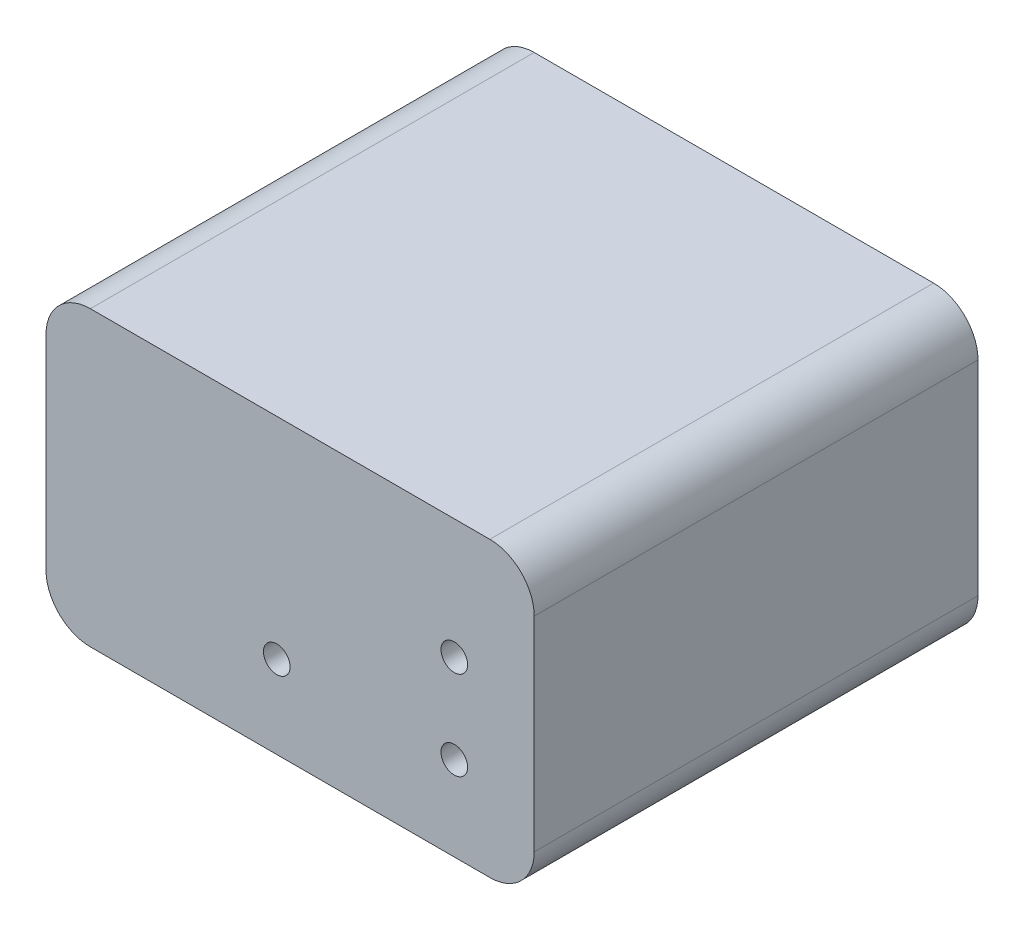
from build123d import *

# Parameters (mm, degrees)
ESQUISSE1_W             = 55
ESQUISSE1_H             = 33
BOSS_EXTRU_1_DEPTH      = 50
ENL_V_MAT_EXTRU_2_DEPTH = 45
CONG_1_R                = 5
ESQUISSE3_R             = 1.5
ENL_V_MAT_EXTRU_3_DEPTH = 10
ENL_V_MAT_EXTRU_4_DEPTH = 2


with BuildPart() as part:
    # Esquisse1 → Boss.-Extru.1 (new body)
    with BuildSketch(Plane.XY):
        with Locations((-27.5, 16.5)):
            Rectangle(ESQUISSE1_W, ESQUISSE1_H)
    extrude(amount=BOSS_EXTRU_1_DEPTH)

    # Esquisse2 → Enlèv. mat.-Extru.2 (cut)
    with BuildSketch(Plane.XY):
        with BuildLine():
            Line((-39, 29), (-16, 29))
            ThreePointArc((-16, 29), (-3, 16), (-16, 3))
            Line((-16, 3), (-39, 3))
            ThreePointArc((-39, 3), (-52, 16), (-39, 29))
        make_face()
    extrude(amount=ENL_V_MAT_EXTRU_2_DEPTH, mode=Mode.SUBTRACT)

    # Congé1
    cong_1_edges = [part.edges().sort_by_distance(p)[0] for p in [
        (0, 0, 25),
        (-55, 0, 25),
        (-55, 33, 25),
        (0, 33, 25),
    ]]
    fillet(cong_1_edges, radius=CONG_1_R)

    # Esquisse3 → Enlèv. mat.-Extru.3 (cut)
    with BuildSketch(Plane.XY.offset(50)):
        with Locations((-29, 9.3)):
            Circle(ESQUISSE3_R)
        with Locations((-9, 19.5)):
            Circle(ESQUISSE3_R)
        with Locations((-9, 9.5)):
            Circle(ESQUISSE3_R)
    extrude(amount=-ENL_V_MAT_EXTRU_3_DEPTH, mode=Mode.SUBTRACT)

    # Esquisse4 → Enlèv. mat.-Extru.4 (cut)
    with BuildSketch(Plane(origin=(0, 0, 45), x_dir=(-1, 0, 0), z_dir=(0, 0, -1))):
        Polygon((27.354551733, 6.45), (30.645448267, 6.45), (32.290896534, 9.3), (30.645448267, 12.15), (27.354551733, 12.15), (25.709103466, 9.3), align=None)
        Polygon((7.354551733, 6.65), (10.645448267, 6.65), (12.290896534, 9.5), (10.645448267, 12.35), (7.354551733, 12.35), (5.709103466, 9.5), align=None)
        Polygon((7.354551733, 16.65), (10.645448267, 16.65), (12.290896534, 19.5), (10.645448267, 22.35), (7.354551733, 22.35), (5.709103466, 19.5), align=None)
    extrude(amount=-ENL_V_MAT_EXTRU_4_DEPTH, mode=Mode.SUBTRACT)


solid = part.part
